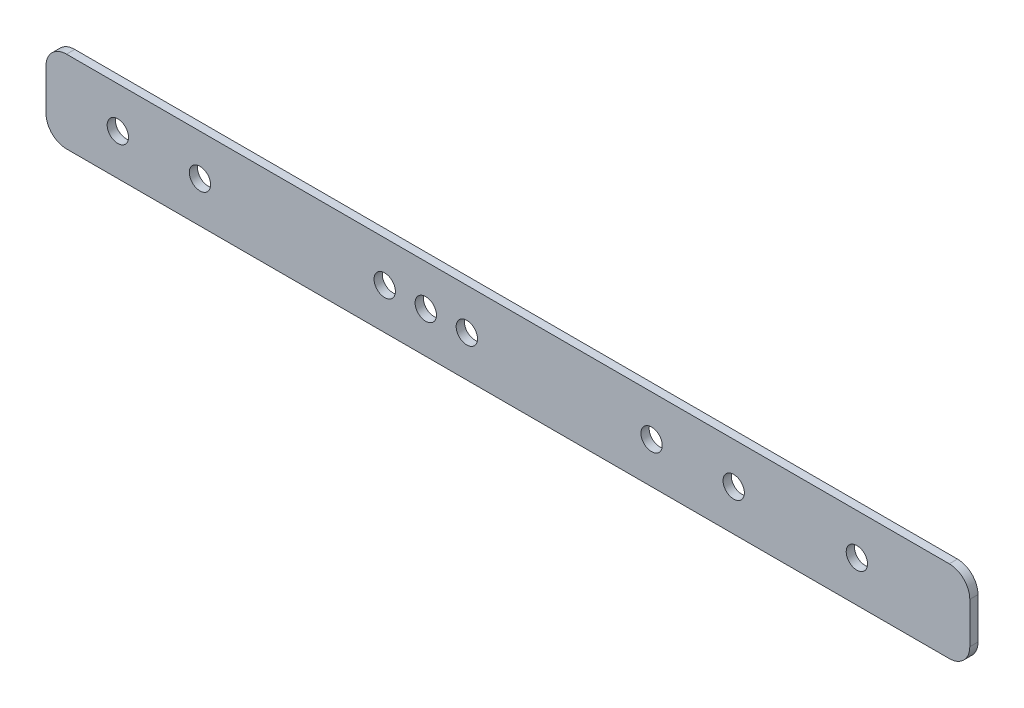
from build123d import *

# Parameters (mm, degrees)
SKETCH_1_W          = 225
SKETCH_1_H          = 20
EXTRUDE_1_DEPTH     = 2
SKETCH_2_R          = 2.6
CUT_EXTRUDE_1_DEPTH = 113.961276551
FILLET_1_R          = 5


with BuildPart() as part:
    # 草图1 → 凸台-拉伸1 (new body)
    with BuildSketch(Plane.XY):
        Rectangle(SKETCH_1_W, SKETCH_1_H)
    extrude(amount=EXTRUDE_1_DEPTH)

    # 草图2 → 切除-拉伸1 (cut, through all)
    with BuildSketch(Plane(origin=(0, 0, 0), x_dir=(-1, 0, 0), z_dir=(0, 0, -1))):
        with Locations((95, 0)):
            Circle(SKETCH_2_R)
        with Locations((75, 0)):
            Circle(SKETCH_2_R)
        with Locations((30, 0)):
            Circle(SKETCH_2_R)
        with Locations((20, 0)):
            Circle(SKETCH_2_R)
        with Locations((10, 0)):
            Circle(SKETCH_2_R)
        with Locations((-35, 0)):
            Circle(SKETCH_2_R)
        with Locations((-55, 0)):
            Circle(SKETCH_2_R)
        with Locations((-85, 0)):
            Circle(SKETCH_2_R)
    extrude(amount=-CUT_EXTRUDE_1_DEPTH, mode=Mode.SUBTRACT)

    # 圆角1
    fillet_1_edges = [part.edges().sort_by_distance(p)[0] for p in [
        (112.5, -10, 1),
        (-112.5, -10, 1),
        (-112.5, 10, 1),
        (112.5, 10, 1),
    ]]
    fillet(fillet_1_edges, radius=FILLET_1_R)


solid = part.part
